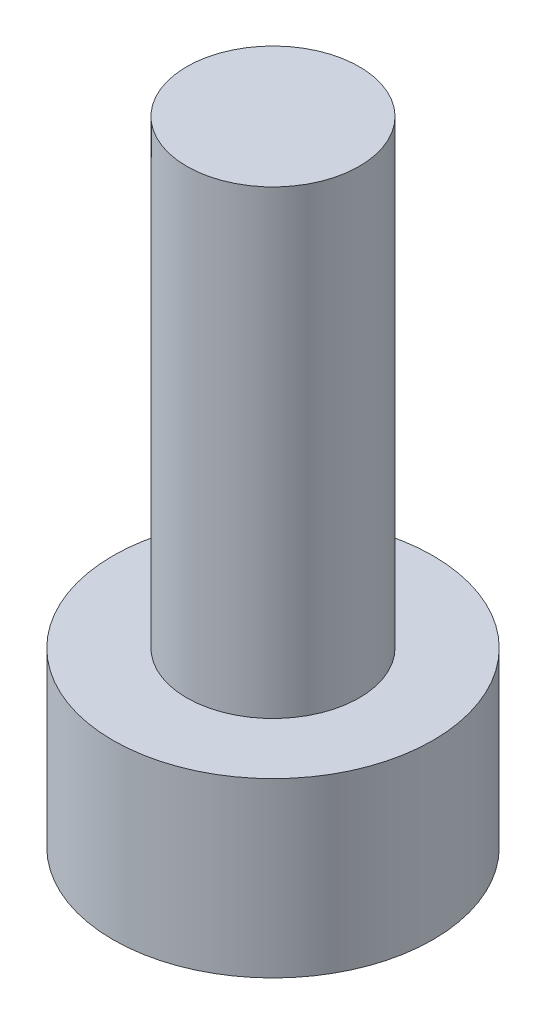
from build123d import *

# Parameters (mm, degrees)
SKETCH1_R           = 2.78
BOSS_EXTRUDE1_DEPTH = 3
SKETCH2_R           = 1.5
BOSS_EXTRUDE2_DEPTH = 8


with BuildPart() as part:
    # Sketch1 → Boss-Extrude1 (new body)
    with BuildSketch(Plane(origin=(0, 0, 0), x_dir=(1, 0, 0), z_dir=(0, 1, 0))):
        with Locations(Location((0, 0, 0), (0, 0, 270))):
            Circle(SKETCH1_R)
    extrude(amount=BOSS_EXTRUDE1_DEPTH)

    # Sketch2 → Boss-Extrude2 (add)
    with BuildSketch(Plane(origin=(0, 3, 0), x_dir=(1, 0, 0), z_dir=(0, 1, 0))):
        with Locations(Location((0, 0, 0), (0, 0, 270))):
            Circle(SKETCH2_R)
    extrude(amount=BOSS_EXTRUDE2_DEPTH)


solid = part.part
